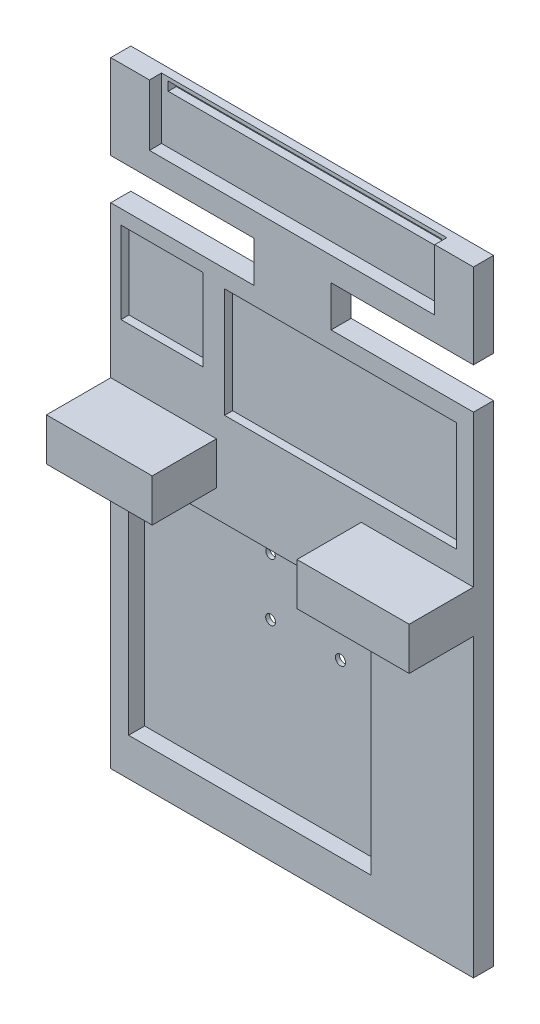
from build123d import *

# Parameters (mm, degrees)
BASE_DEPTH                = 5
ESBO_O2_W                 = 71.017341725
ESBO_O2_H                 = 15.188699459
SENSOR_DEPTH              = 3
EXTENS_O_BASE_BY          = 41.124942484
ESBO_O3_W                 = 68.089828176
ESBO_O3_H                 = 2.204794608
FURO_SENSOR_DEPTH         = 10
ESBO_O5_R                 = 1.188185025
ESBO_O5_R_2               = 1.258078261
ESBO_O5_R_3               = 1.220632904
CONECTOR_RODA_BAMBA_DEPTH = 10
ESBO_O8_W                 = 20.37740853
ESBO_O8_H                 = 20.377408531
PONTE_H_DEPTH             = 2
ESBO_O10_W                = 57.764058892
ESBO_O10_H                = 27.282150264
ESP_DEPTH                 = 2
ESBO_O11_W                = 27.929189737
ESBO_O11_H                = 10.609725103
ESBO_O11_W_2              = 26.320868842
RESSALTO_EXTRUS_O2_DEPTH  = 16
ESBO_O13_W                = 60.293581274
ESBO_O13_H                = 57.562513133
CORTE_EXTRUS_O12_DEPTH    = 4


with BuildPart() as part:
    # Esboço1 → base (new body)
    with BuildSketch(Plane.XY):
        Polygon((-44.67348187, 40.715072084), (-44.67348187, 19.603553226), (-9.047793796, 19.603553226), (-9.047793796, 9.424785205), (-44.67348187, 9.424785205), (-44.67348187, -71.439871851), (45.61596039, -71.439871851), (45.61596039, 9.424785205), (10.178768021, 9.424785205), (10.178768021, 19.603553226), (45.61596039, 19.603553226), (45.61596039, 40.715072084), align=None)
    extrude(amount=BASE_DEPTH)

    # Esboço2 → sensor (cut)
    with BuildSketch(Plane.XY.offset(5)):
        with Locations((0.47123926, 33.120722355)):
            Rectangle(ESBO_O2_W, ESBO_O2_H)
    extrude(amount=-SENSOR_DEPTH, mode=Mode.SUBTRACT)

    # extensão base: a face moved outward by 41.124942
    extrude(part.faces().sort_by_distance((0.47123926, -71.439871851, 2.5))[0], amount=EXTENS_O_BASE_BY, dir=(0, -1, 0))

    # Esboço3 → "furo" sensor (cut)
    with BuildSketch(Plane.XY.offset(2)):
        with Locations((0.67810757, 38.709026673)):
            Rectangle(ESBO_O3_W, ESBO_O3_H)
    extrude(amount=-FURO_SENSOR_DEPTH, mode=Mode.SUBTRACT)

    # Esboço5 → conector roda bamba (cut)
    with BuildSketch(Plane(origin=(0, 0, 0), x_dir=(-1, 0, 0), z_dir=(0, 0, -1))):
        with Locations((-8.517583176, -50.2919249)):
            Circle(ESBO_O5_R)
        with Locations((-8.517583176, -64.550145197)):
            Circle(ESBO_O5_R_2)
        with Locations((8.885832774, -64.550145197)):
            Circle(ESBO_O5_R_3)
        with Locations((8.885832774, -50.2919249)):
            Circle(ESBO_O5_R)
    extrude(amount=-CONECTOR_RODA_BAMBA_DEPTH, mode=Mode.SUBTRACT)

    # Esboço8 → ponte H (cut)
    with BuildSketch(Plane.XY.offset(5)):
        with Locations((-31.939333104, -4.30205468)):
            Rectangle(ESBO_O8_W, ESBO_O8_H)
    extrude(amount=-PONTE_H_DEPTH, mode=Mode.SUBTRACT)

    # Esboço10 → esp (cut)
    with BuildSketch(Plane.XY.offset(5)):
        with Locations((12.550316437, -8.596467221)):
            Rectangle(ESBO_O10_W, ESBO_O10_H)
    extrude(amount=-ESP_DEPTH, mode=Mode.SUBTRACT)

    # Esboço11 → Ressalto-extrusão2 (add)
    with BuildSketch(Plane.XY.offset(5)):
        with Locations((31.651365522, -33.605104963)):
            Rectangle(ESBO_O11_W, ESBO_O11_H)
        with Locations((-31.513047449, -33.605104963)):
            Rectangle(ESBO_O11_W_2, ESBO_O11_H)
    extrude(amount=RESSALTO_EXTRUS_O2_DEPTH)

    # Esboço13 → Corte-extrusão12 (cut)
    with BuildSketch(Plane.XY.offset(5)):
        with Locations((-10.073047237, -74.36990727)):
            Rectangle(ESBO_O13_W, ESBO_O13_H)
    extrude(amount=-CORTE_EXTRUS_O12_DEPTH, mode=Mode.SUBTRACT)


solid = part.part
